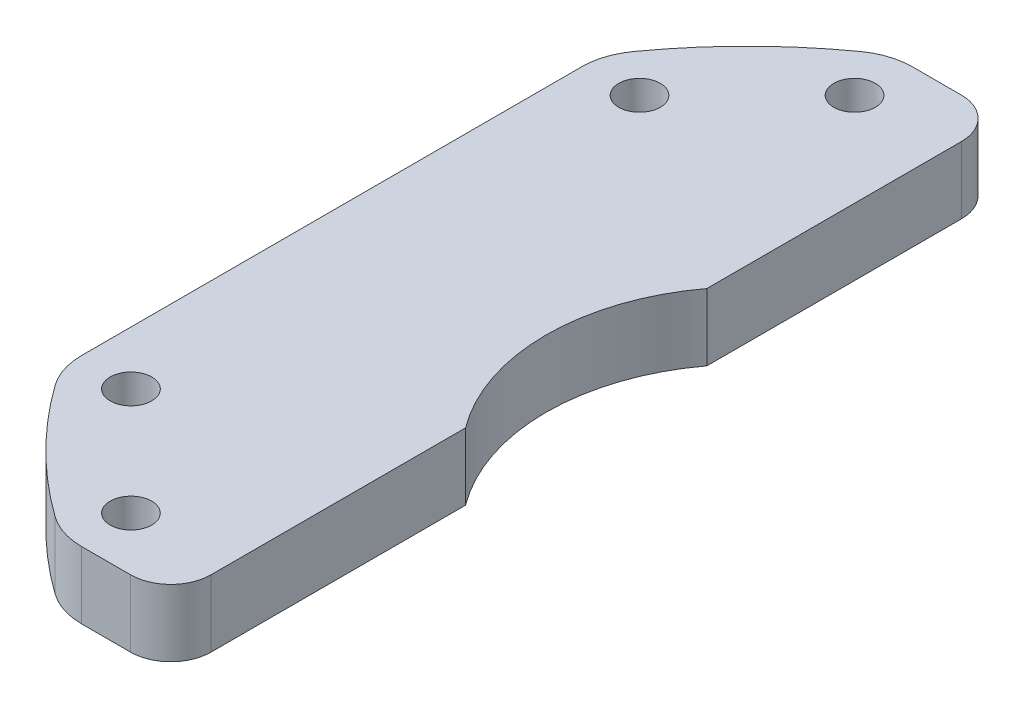
from build123d import *

# Parameters (mm, degrees)
EXTRUDE_1_DEPTH     = 5
SKETCH_2_R          = 15
CUT_EXTRUDE_1_DEPTH = 10
SKETCH_3_R          = 1.55
CUT_EXTRUDE_2_DEPTH = 10
SKETCH_7_W          = 49.108203812
SKETCH_7_H          = 84.922292299
CUT_EXTRUDE_4_DEPTH = 10
FILLET_1_R          = 3
FILLET_2_R          = 5


with BuildPart() as part:
    # 草图1 → 凸台-拉伸1 (new body)
    with BuildSketch(Plane(origin=(0, 0, 0), x_dir=(1, 0, 0), z_dir=(0, 1, 0))):
        with BuildLine():
            Line((-20.199009877, 31), (20.199009877, 31))
            ThreePointArc((20.199009877, 31), (26.162950904, 26.162950904), (31, 20.199009877))
            Line((31, 20.199009877), (31, -20.199009877))
            ThreePointArc((31, -20.199009877), (26.162950904, -26.162950904), (20.199009877, -31))
            Line((20.199009877, -31), (-20.199009877, -31))
            ThreePointArc((-20.199009877, -31), (-26.162950904, -26.162950904), (-31, -20.199009877))
            Line((-31, -20.199009877), (-31, 20.199009877))
            ThreePointArc((-31, 20.199009877), (-26.162950904, 26.162950904), (-20.199009877, 31))
        make_face()
    extrude(amount=EXTRUDE_1_DEPTH)

    # 草图2 → 切除-拉伸1 (cut)
    with BuildSketch(Plane(origin=(0, 5, 0), x_dir=(1, 0, 0), z_dir=(0, 1, 0))):
        with Locations(Location((0, 0, 0), (0, 0, 270))):
            Circle(SKETCH_2_R)
    extrude(amount=-CUT_EXTRUDE_1_DEPTH, mode=Mode.SUBTRACT)

    # 草图3 → 切除-拉伸2 (cut)
    with BuildSketch(Plane(origin=(0, 5, 0), x_dir=(1, 0, 0), z_dir=(0, 1, 0))):
        with Locations(Location((-26.998940675, 18.975173317, 0), (0, 0, 270))):
            Circle(SKETCH_3_R)
        with Locations(Location((-18.975173317, 26.998940675, 0), (0, 0, 270))):
            Circle(SKETCH_3_R)
        with Locations(Location((26.998940675, 18.975173317, 0), (0, 0, 270))):
            Circle(SKETCH_3_R)
        with Locations(Location((18.975173317, 26.998940675, 0), (0, 0, 270))):
            Circle(SKETCH_3_R)
        with Locations(Location((26.998940675, -18.975173317, 0), (0, 0, 270))):
            Circle(SKETCH_3_R)
        with Locations(Location((18.975173317, -26.998940675, 0), (0, 0, 270))):
            Circle(SKETCH_3_R)
        with Locations(Location((-26.998940675, -18.975173317, 0), (0, 0, 270))):
            Circle(SKETCH_3_R)
        with Locations(Location((-18.975173317, -26.998940675, 0), (0, 0, 270))):
            Circle(SKETCH_3_R)
    extrude(amount=-CUT_EXTRUDE_2_DEPTH, mode=Mode.SUBTRACT)

    # 草图7 → 切除-拉伸4 (cut)
    with BuildSketch(Plane(origin=(0, 5, 0), x_dir=(1, 0, 0), z_dir=(0, 1, 0))):
        with Locations((12.554101906, 6.469881358)):
            Rectangle(SKETCH_7_W, SKETCH_7_H)
    extrude(amount=-CUT_EXTRUDE_4_DEPTH, mode=Mode.SUBTRACT)

    # 圆角1
    fillet_1_edges = [part.edges().sort_by_distance(p)[0] for p in [
        (-12, 2.5, 31),
        (-12, 2.5, -31),
    ]]
    fillet(fillet_1_edges, radius=FILLET_1_R)

    # 圆角2
    fillet_2_edges = [part.edges().sort_by_distance(p)[0] for p in [
        (-20.199009877, 2.5, -31),
        (-20.199009877, 2.5, 31),
        (-31, 2.5, 20.199009877),
        (-31, 2.5, -20.199009877),
    ]]
    fillet(fillet_2_edges, radius=FILLET_2_R)


solid = part.part
